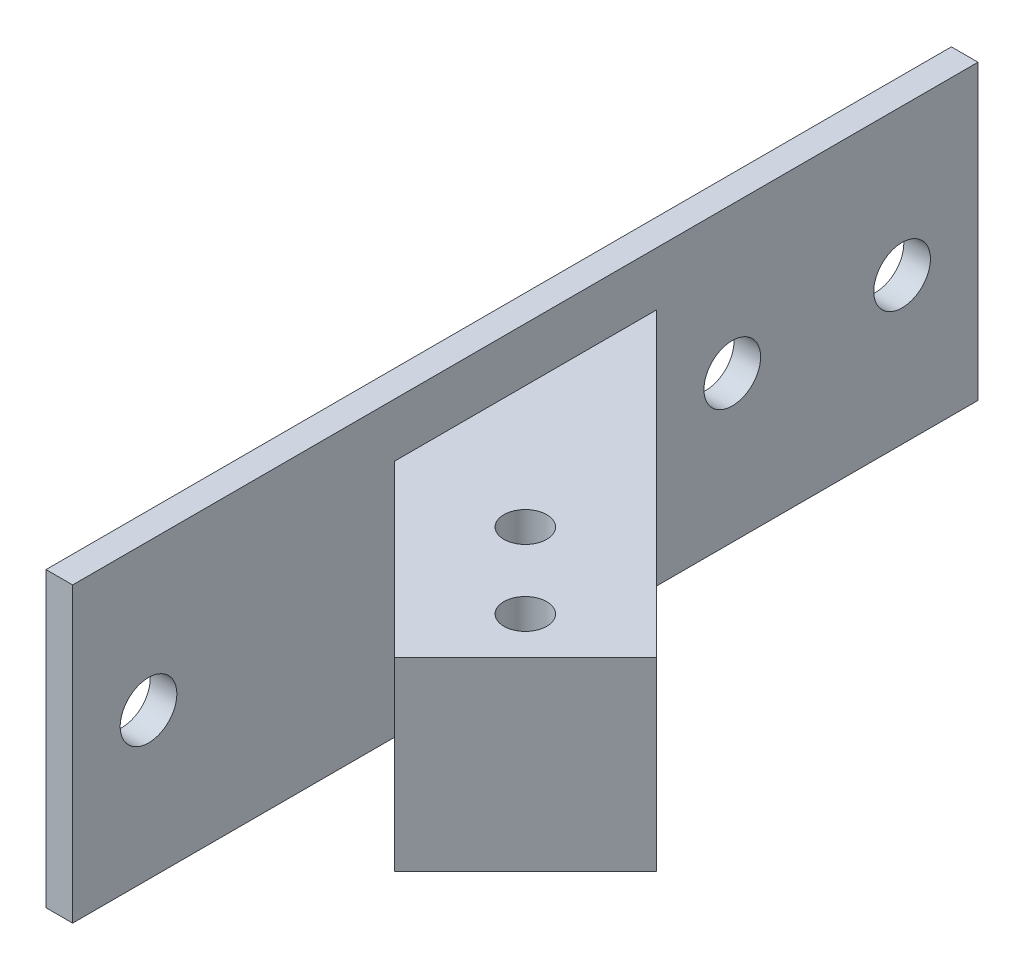
from build123d import *

# Parameters (mm, degrees)
SKETCH1_W               = 107.95
SKETCH1_H               = 34.925
BOSS_EXTRUDE1_DEPTH     = 3.175
BOSS_EXTRUDE2_REACH     = 92.429
SKETCH4_W               = 22.098
SKETCH4_H               = 22.098
CUT_EXTRUDE1_REACH      = 69.122
SKETCH5_R               = 3.3782
F_1_4_20_TAPPED_HOLE1_D = 5.1054


with BuildPart() as part:
    # Sketch1 → Boss-Extrude1 (new body)
    with BuildSketch(Plane(origin=(0, 0, 0), x_dir=(0, 0, -1), z_dir=(1, 0, 0))):
        Rectangle(SKETCH1_W, SKETCH1_H)
    extrude(amount=BOSS_EXTRUDE1_DEPTH)

    # Boss-Extrude2: up to this plane
    boss_extrude2_end = Plane(origin=(3.175, 0, 0), z_dir=(1, 0, 0))
    # Sketch4 → Boss-Extrude2 (add, up to the surface)
    with BuildSketch(Plane(origin=(29.650800378, 0, 29.650800378), x_dir=(0.707106781186546, 0, -0.707106781186549), z_dir=(0.707106781186549, 0, 0.707106781186546)), mode=Mode.PRIVATE) as boss_extrude2_sk1:
        with Locations((2.24506403, 0)):
            Rectangle(SKETCH4_W, SKETCH4_H)
    boss_extrude2_tool1 = split(extrude(boss_extrude2_sk1.sketch, amount=-BOSS_EXTRUDE2_REACH, mode=Mode.PRIVATE), bisect_by=boss_extrude2_end, keep=Keep.BOTH, mode=Mode.PRIVATE)
    add(boss_extrude2_tool1.solids().sort_by_distance((31.2383, 0, 28.0633))[0])

    # Sketch5 → Cut-Extrude1 (cut, up to next)
    with BuildSketch(Plane(origin=(3.175, 0, 0), x_dir=(0, 0, -1), z_dir=(1, 0, 0)), mode=Mode.PRIVATE) as cut_extrude1_sk1:
        with Locations((-44.925561602, 0)):
            Circle(SKETCH5_R)
    cut_extrude1_tool1 = extrude(cut_extrude1_sk1.sketch, amount=-CUT_EXTRUDE1_REACH, mode=Mode.PRIVATE) & part.part
    # Sketch5 → Cut-Extrude1 (cut, up to next)
    with BuildSketch(Plane(origin=(3.175, 0, 0), x_dir=(0, 0, -1), z_dir=(1, 0, 0)), mode=Mode.PRIVATE) as cut_extrude1_sk2:
        with Locations((24.675084049, 0)):
            Circle(SKETCH5_R)
    cut_extrude1_tool2 = extrude(cut_extrude1_sk2.sketch, amount=-CUT_EXTRUDE1_REACH, mode=Mode.PRIVATE) & part.part
    # Sketch5 → Cut-Extrude1 (cut, up to next)
    with BuildSketch(Plane(origin=(3.175, 0, 0), x_dir=(0, 0, -1), z_dir=(1, 0, 0)), mode=Mode.PRIVATE) as cut_extrude1_sk3:
        with Locations((44.925561602, 0)):
            Circle(SKETCH5_R)
    cut_extrude1_tool3 = extrude(cut_extrude1_sk3.sketch, amount=-CUT_EXTRUDE1_REACH, mode=Mode.PRIVATE) & part.part
    add(cut_extrude1_tool1.solids().sort_by_distance((3.175, 0, 44.925562))[0], mode=Mode.SUBTRACT)
    add(cut_extrude1_tool2.solids().sort_by_distance((3.175, 0, -24.675084))[0], mode=Mode.SUBTRACT)
    add(cut_extrude1_tool3.solids().sort_by_distance((3.175, 0, -44.925562))[0], mode=Mode.SUBTRACT)

    # 1/4-20 Tapped Hole1 (through all)
    with Locations(Plane(origin=(0, 11.049, 0), x_dir=(1, 0, 0), z_dir=(0, 1, 0))):
        with Locations((17.767916197, -14.592916197), (26.748172318, -23.573172318)):
            Hole(F_1_4_20_TAPPED_HOLE1_D / 2)


solid = part.part
